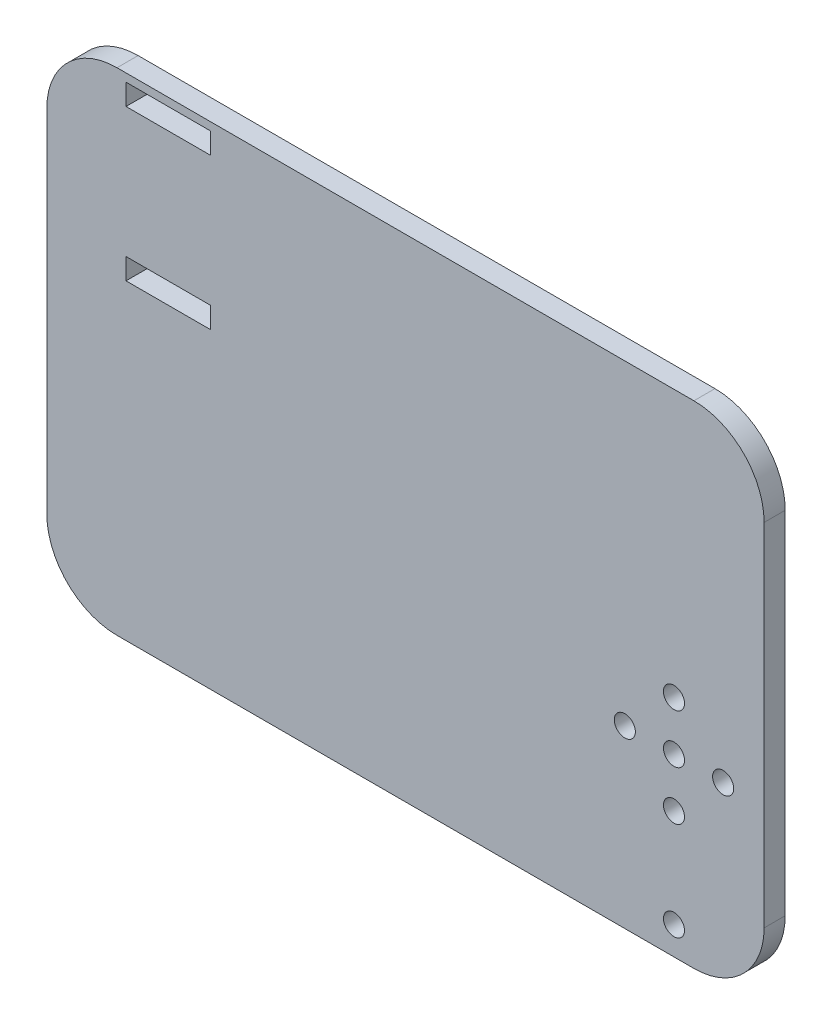
from build123d import *

# Parameters (mm, degrees)
BOSS_EXTRUDE1_DEPTH = 3
SKETCH3_OUTSIDE_W   = 181.071
SKETCH3_OUTSIDE_H   = 249.846
SKETCH3_OUTSIDE_W_2 = 131.224989992
SKETCH3_OUTSIDE_H_2 = 70
CUT_EXTRUDE2_DEPTH  = 10
CUT_EXTRUDE3_REACH  = 111.7
SKETCH4_R           = 1.5
CUT_EXTRUDE4_REACH  = 111.7
SKETCH5_W           = 48.153954936
SKETCH5_H           = 90
CUT_EXTRUDE5_REACH  = 111.7
SKETCH6_W           = 16.692706212
SKETCH6_H           = 90.485388772
FILLET1_R           = 10
CUT_EXTRUDE6_REACH  = 102.045
SKETCH8_W           = 12
SKETCH8_H           = 3


with BuildPart() as part:
    # Sketch1 → Boss-Extrude1 (new body)
    with BuildSketch(Plane.XY):
        with BuildLine():
            Line((31.224989992, -95), (31.224989992, 95))
            ThreePointArc((31.224989992, 95), (-100, 0), (31.224989992, -95))
        make_face()
    extrude(amount=BOSS_EXTRUDE1_DEPTH)

    # Sketch3 outside → Cut-Extrude2 (cut)
    with BuildSketch(Plane.XY.offset(3)):
        with Locations((-34.3875, 0)):
            Rectangle(SKETCH3_OUTSIDE_W, SKETCH3_OUTSIDE_H)
        with Locations((-34.387505004, 10)):
            Rectangle(SKETCH3_OUTSIDE_W_2, SKETCH3_OUTSIDE_H_2, mode=Mode.SUBTRACT)
    extrude(amount=-CUT_EXTRUDE2_DEPTH, mode=Mode.SUBTRACT)

    # Sketch4 → Cut-Extrude3 (cut, up to next)
    with BuildSketch(Plane.XY.offset(3), mode=Mode.PRIVATE) as cut_extrude3_sk1:
        with Locations((0, 7)):
            Circle(SKETCH4_R)
    cut_extrude3_tool1 = extrude(cut_extrude3_sk1.sketch, amount=-CUT_EXTRUDE3_REACH, mode=Mode.PRIVATE) & part.part
    # Sketch4 → Cut-Extrude3 (cut, up to next)
    with BuildSketch(Plane.XY.offset(3), mode=Mode.PRIVATE) as cut_extrude3_sk2:
        with Locations((0, -7)):
            Circle(SKETCH4_R)
    cut_extrude3_tool2 = extrude(cut_extrude3_sk2.sketch, amount=-CUT_EXTRUDE3_REACH, mode=Mode.PRIVATE) & part.part
    # Sketch4 → Cut-Extrude3 (cut, up to next)
    with BuildSketch(Plane.XY.offset(3), mode=Mode.PRIVATE) as cut_extrude3_sk3:
        with Locations((7, 0)):
            Circle(SKETCH4_R)
    cut_extrude3_tool3 = extrude(cut_extrude3_sk3.sketch, amount=-CUT_EXTRUDE3_REACH, mode=Mode.PRIVATE) & part.part
    # Sketch4 → Cut-Extrude3 (cut, up to next)
    with BuildSketch(Plane.XY.offset(3), mode=Mode.PRIVATE) as cut_extrude3_sk4:
        with Locations((-7, 0)):
            Circle(SKETCH4_R)
    cut_extrude3_tool4 = extrude(cut_extrude3_sk4.sketch, amount=-CUT_EXTRUDE3_REACH, mode=Mode.PRIVATE) & part.part
    # Sketch4 → Cut-Extrude3 (cut, up to next)
    with BuildSketch(Plane.XY.offset(3), mode=Mode.PRIVATE) as cut_extrude3_sk5:
        Circle(SKETCH4_R)
    cut_extrude3_tool5 = extrude(cut_extrude3_sk5.sketch, amount=-CUT_EXTRUDE3_REACH, mode=Mode.PRIVATE) & part.part
    # Sketch4 → Cut-Extrude3 (cut, up to next)
    with BuildSketch(Plane.XY.offset(3), mode=Mode.PRIVATE) as cut_extrude3_sk6:
        with Locations((0, -21)):
            Circle(SKETCH4_R)
    cut_extrude3_tool6 = extrude(cut_extrude3_sk6.sketch, amount=-CUT_EXTRUDE3_REACH, mode=Mode.PRIVATE) & part.part
    add(cut_extrude3_tool1.solids().sort_by_distance((0, 7, 3))[0], mode=Mode.SUBTRACT)
    add(cut_extrude3_tool2.solids().sort_by_distance((0, -7, 3))[0], mode=Mode.SUBTRACT)
    add(cut_extrude3_tool3.solids().sort_by_distance((7, 0, 3))[0], mode=Mode.SUBTRACT)
    add(cut_extrude3_tool4.solids().sort_by_distance((-7, 0, 3))[0], mode=Mode.SUBTRACT)
    add(cut_extrude3_tool5.solids().sort_by_distance((0, 0, 3))[0], mode=Mode.SUBTRACT)
    add(cut_extrude3_tool6.solids().sort_by_distance((0, -21, 3))[0], mode=Mode.SUBTRACT)

    # Sketch5 → Cut-Extrude4 (cut, up to next)
    with BuildSketch(Plane.XY.offset(3), mode=Mode.PRIVATE) as cut_extrude4_sk1:
        with Locations((36.913108842, 0)):
            Rectangle(SKETCH5_W, SKETCH5_H)
    cut_extrude4_tool1 = extrude(cut_extrude4_sk1.sketch, amount=-CUT_EXTRUDE4_REACH, mode=Mode.PRIVATE) & part.part
    add(cut_extrude4_tool1.solids().sort_by_distance((36.913109, 0, 3))[0], mode=Mode.SUBTRACT)

    # Sketch6 → Cut-Extrude5 (cut, up to next)
    with BuildSketch(Plane.XY.offset(3), mode=Mode.PRIVATE) as cut_extrude5_sk1:
        with Locations((-97.649208603, -0.242694386)):
            Rectangle(SKETCH6_W, SKETCH6_H)
    cut_extrude5_tool1 = extrude(cut_extrude5_sk1.sketch, amount=-CUT_EXTRUDE5_REACH, mode=Mode.PRIVATE) & part.part
    add(cut_extrude5_tool1.solids().sort_by_distance((-97.649209, -0.242694, 3))[0], mode=Mode.SUBTRACT)

    # Fillet1
    fillet1_edges = [part.edges().sort_by_distance(p)[0] for p in [
        (-89.302855497, 45, 1.5),
        (12.836131374, -25, 1.5),
        (12.836131374, 45, 1.5),
        (-89.302855497, -25, 1.5),
    ]]
    fillet(fillet1_edges, radius=FILLET1_R)

    # Sketch8 → Cut-Extrude6 (cut, up to next)
    with BuildSketch(Plane.XY.offset(3), mode=Mode.PRIVATE) as cut_extrude6_sk1:
        with Locations((-72.023868626, 42.359338222)):
            Rectangle(SKETCH8_W, SKETCH8_H)
    cut_extrude6_tool1 = extrude(cut_extrude6_sk1.sketch, amount=-CUT_EXTRUDE6_REACH, mode=Mode.PRIVATE) & part.part
    # Sketch8 → Cut-Extrude6 (cut, up to next)
    with BuildSketch(Plane.XY.offset(3), mode=Mode.PRIVATE) as cut_extrude6_sk2:
        with Locations((-72.023868626, 20.859338222)):
            Rectangle(SKETCH8_W, SKETCH8_H)
    cut_extrude6_tool2 = extrude(cut_extrude6_sk2.sketch, amount=-CUT_EXTRUDE6_REACH, mode=Mode.PRIVATE) & part.part
    add(cut_extrude6_tool1.solids().sort_by_distance((-72.023869, 42.359338, 3))[0], mode=Mode.SUBTRACT)
    add(cut_extrude6_tool2.solids().sort_by_distance((-72.023869, 20.859338, 3))[0], mode=Mode.SUBTRACT)


solid = part.part
